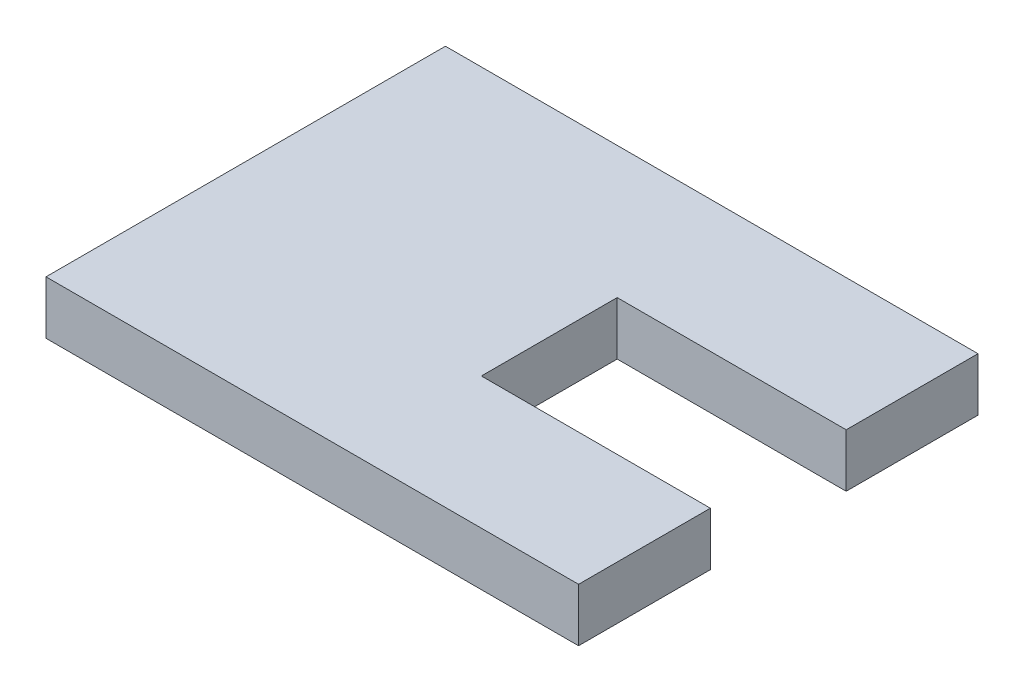
from build123d import *

# Parameters (mm, degrees)
SKETCH_1_W          = 40
SKETCH_1_H          = 30
EXTRUDE_1_DEPTH     = 4
SKETCH_2_W          = 22.2
SKETCH_2_H          = 10.2
CUT_EXTRUDE_1_DEPTH = 10
SKETCH_3_W          = 10.2
SKETCH_3_H          = 4
EXTRUDE_2_DEPTH     = 5


with BuildPart() as part:
    # 草圖1 → 填料-伸長1 (new body)
    with BuildSketch(Plane(origin=(0, 0, 0), x_dir=(1, 0, 0), z_dir=(0, 1, 0))):
        with Locations((20, 15)):
            Rectangle(SKETCH_1_W, SKETCH_1_H)
    extrude(amount=EXTRUDE_1_DEPTH)

    # 草圖2 → 除料-伸長1 (cut)
    with BuildSketch(Plane(origin=(0, 4, 0), x_dir=(1, 0, 0), z_dir=(0, 1, 0))):
        with Locations((28.9, 15)):
            Rectangle(SKETCH_2_W, SKETCH_2_H)
    extrude(amount=-CUT_EXTRUDE_1_DEPTH, mode=Mode.SUBTRACT)

    # 草圖3 → 填料-伸長2 (add)
    with BuildSketch(Plane(origin=(17.8, 0, 0), x_dir=(0, 0, -1), z_dir=(1, 0, 0))):
        with Locations((15, 2)):
            Rectangle(SKETCH_3_W, SKETCH_3_H)
    extrude(amount=EXTRUDE_2_DEPTH)


solid = part.part
